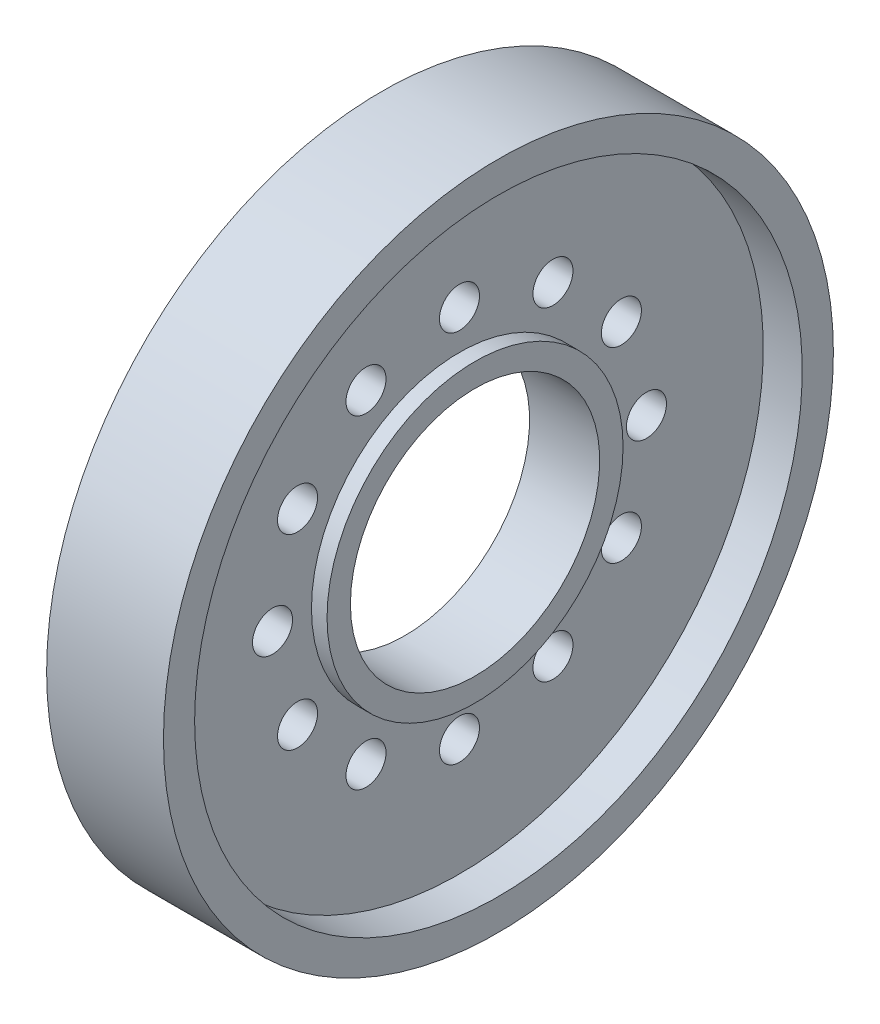
from build123d import *

# Parameters (mm, degrees)
SKETCH2_R          = 3.2639
CUT_EXTRUDE1_DEPTH = 79.267453006
CIRPATTERN1_COUNT  = 12


with BuildPart() as part:
    # Sketch1 → Revolve1 (revolve)
    with BuildSketch(Plane.XY, mode=Mode.PRIVATE) as revolve1_sk:
        Polygon((-9.525, 54.61), (9.525, 54.61), (9.525, 49.53), (3.175, 49.53), (3.175, 24.13), (5.715, 24.13), (5.715, 20.32), (-5.715, 20.32), (-5.715, 24.13), (-3.175, 24.13), (-3.175, 49.53), (-9.525, 49.53), align=None)
    revolve(revolve1_sk.sketch.rotate(Axis((-31.293370787, 0, 0), (1, 0, 0)), 90), axis=Axis((-31.293370787, 0, 0), (1, 0, 0)))

    # Sketch2 → Cut-Extrude1 (cut, through all)
    with BuildSketch(Plane(origin=(3.175, 0, 0), x_dir=(0, 0, -1), z_dir=(1, 0, 0))):
        with Locations((0, 30.48)):
            Circle(SKETCH2_R)
    cut_extrude1 = extrude(amount=-CUT_EXTRUDE1_DEPTH, mode=Mode.SUBTRACT)

    # CirPattern1: Cut-Extrude1 ×12 about axis
    cirpattern1_axis = Axis((0, 0, 0), (1, 0, 0))
    for i in range(1, CIRPATTERN1_COUNT):
        add(cut_extrude1.rotate(cirpattern1_axis, i * 360 / CIRPATTERN1_COUNT), mode=Mode.SUBTRACT)


solid = part.part
